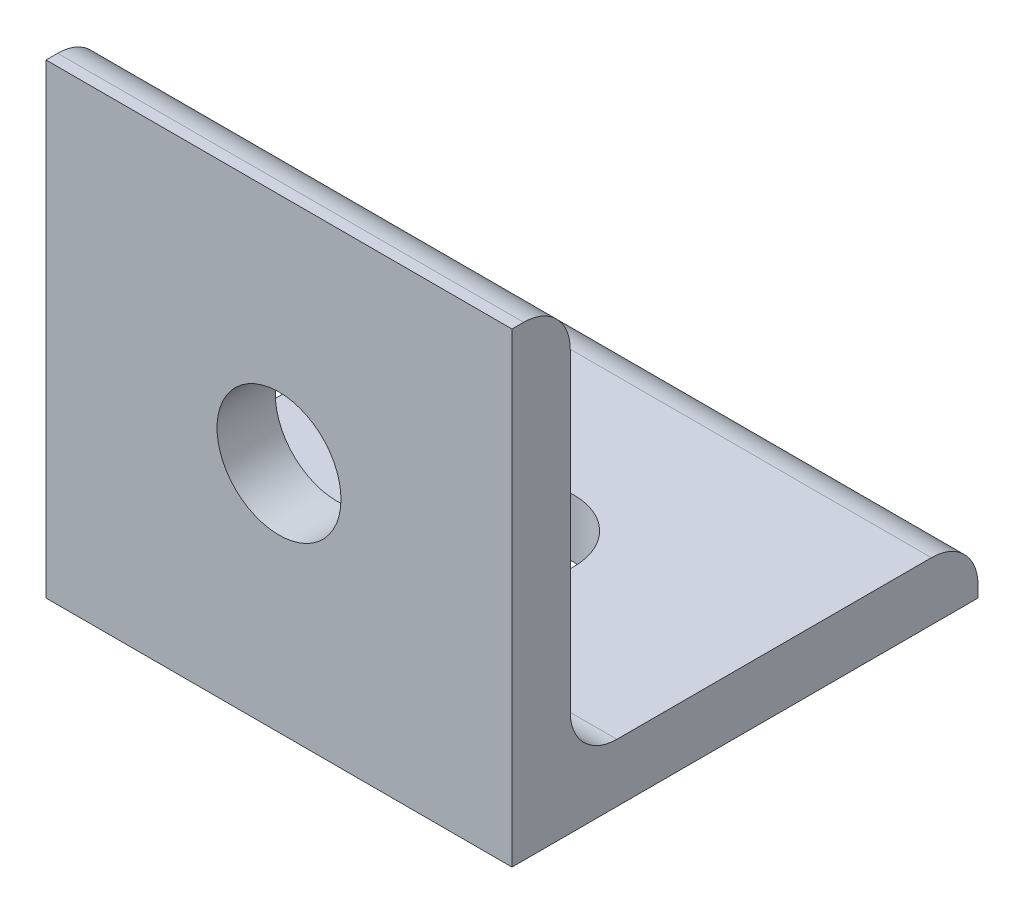
from build123d import *

# Parameters (mm, degrees)
EXTRUDE1_DEPTH          = 12.7
F_1_4_CLEARANCE_HOLE1_D = 6.7564
F_1_4_CLEARANCE_HOLE2_D = 6.7564
FILLET1_R               = 2.54


with BuildPart() as part:
    # Sketch1 → Extrude1 (new, symmetric)
    with BuildSketch(Plane(origin=(0, 0, 0), x_dir=(0, 0, -1), z_dir=(1, 0, 0))):
        Polygon((0, 0), (0, 25.4), (3.175, 25.4), (3.175, 3.175), (25.4, 3.175), (25.4, 0), align=None)
    extrude(amount=EXTRUDE1_DEPTH, both=True)

    # 1/4 Clearance Hole1 (through all)
    with Locations(Plane.XY):
        with Locations((0, 12.7)):
            Hole(F_1_4_CLEARANCE_HOLE1_D / 2)

    # 1/4 Clearance Hole2 (through all)
    with Locations(Plane.XZ):
        with Locations((0, -12.7)):
            Hole(F_1_4_CLEARANCE_HOLE2_D / 2)

    # Fillet1
    fillet1_edges = [part.edges().sort_by_distance(p)[0] for p in [
        (0, 25.4, -3.175),
        (0, 3.175, -3.175),
        (0, 3.175, -25.4),
    ]]
    fillet(fillet1_edges, radius=FILLET1_R)


solid = part.part
